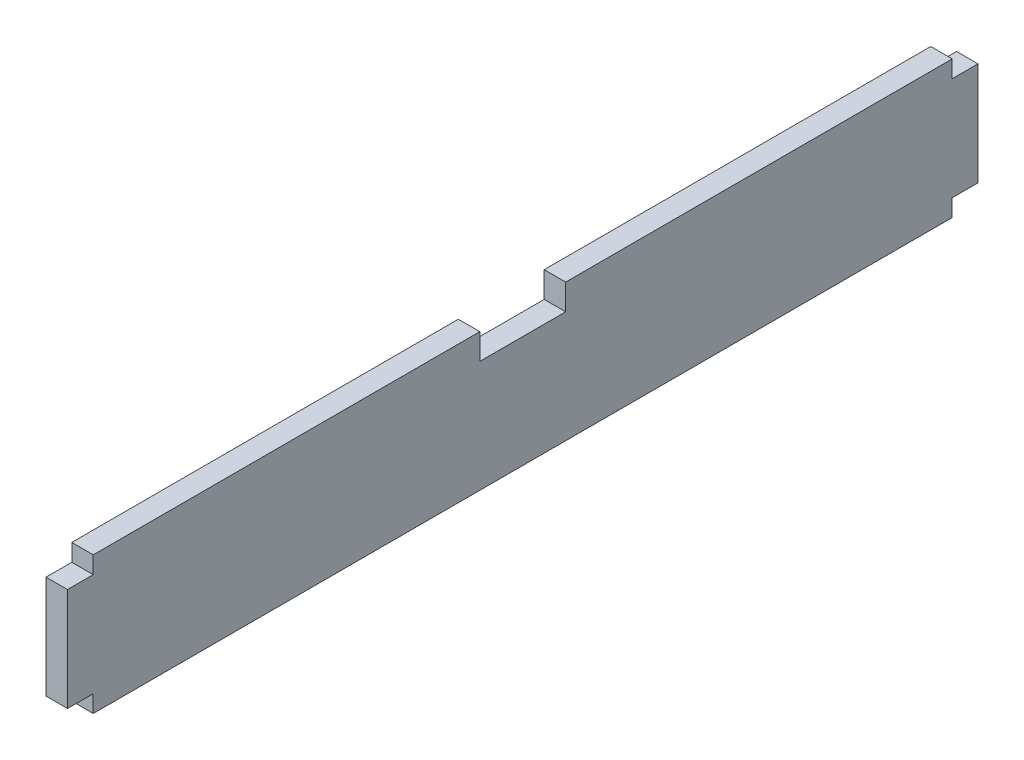
from build123d import *

# Parameters (mm, degrees)
SKETCH1_W           = 2.5
SKETCH1_H           = 16
BOSS_EXTRUDE1_DEPTH = 100
SKETCH1_3_W         = 2.5
SKETCH1_3_H         = 12
BOSS_EXTRUDE2_DEPTH = 3
SKETCH2_W           = 10
SKETCH2_H           = 3
CUT_EXTRUDE1_DEPTH  = 10


with BuildPart() as part:
    # Sketch1 → Boss-Extrude1 (new body)
    with BuildSketch(Plane.XY):
        Rectangle(SKETCH1_W, SKETCH1_H)
    extrude(amount=BOSS_EXTRUDE1_DEPTH)

    # Sketch1<3> → Boss-Extrude2 (add)
    with BuildSketch(Plane.XY):
        Rectangle(SKETCH1_3_W, SKETCH1_3_H)
    boss_extrude2 = extrude(amount=-BOSS_EXTRUDE2_DEPTH)

    # Mirror1: Boss-Extrude2 across plane
    add(boss_extrude2.mirror(Plane(origin=(0, 0, 50), x_dir=(1, 0, 0), z_dir=(0, 0, -1))))

    # Sketch2 → Cut-Extrude1 (cut)
    with BuildSketch(Plane(origin=(1.25, 0, 0), x_dir=(0, 0, -1), z_dir=(1, 0, 0))):
        with Locations((-50, 6.5)):
            Rectangle(SKETCH2_W, SKETCH2_H)
    extrude(amount=-CUT_EXTRUDE1_DEPTH, mode=Mode.SUBTRACT)


solid = part.part
